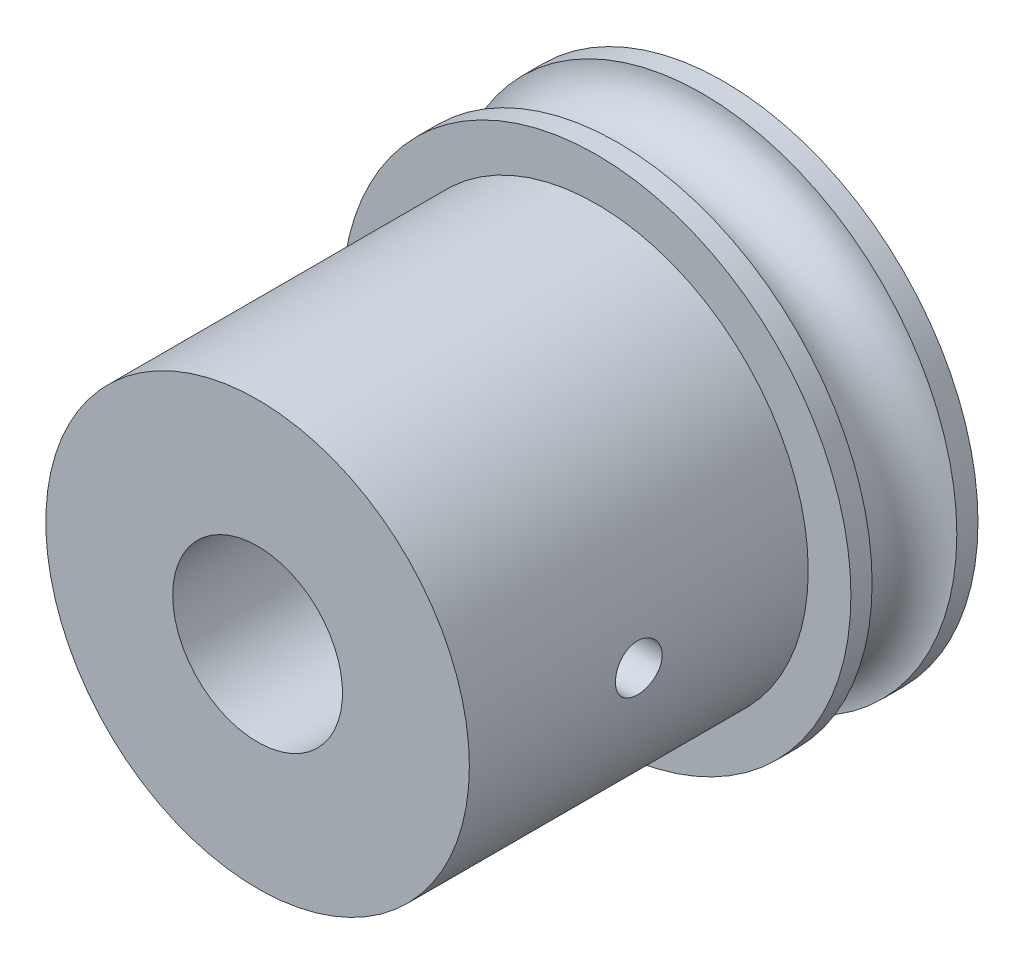
from build123d import *

# Parameters (mm, degrees)
SKETCH2_R           = 7.9375
BOSS_EXTRUDE1_DEPTH = 12.7
HOLE1_D             = 6.3627
SKETCH5_W           = 0.8763
SKETCH5_H           = 6.479418435


with BuildPart() as part:
    # Sketch1 → Revolve1 (revolve)
    with BuildSketch(Plane(origin=(0, 0, 0), x_dir=(1, 0, 0), z_dir=(0, 1, 0))):
        with BuildLine():
            Line((9.5377, 2.38125), (0, 2.38125))
            Line((0, 2.38125), (0, -2.38125))
            Line((0, -2.38125), (9.5377, -2.38125))
            Line((9.5377, -2.38125), (9.5377, -1.5875))
            ThreePointArc((9.5377, -1.5875), (7.9502, 0), (9.5377, 1.5875))
            Line((9.5377, 1.5875), (9.5377, 2.38125))
        make_face()
    revolve(axis=Axis((0, 0, -2.38125), (0, 0, 1)))

    # Sketch2 → Boss-Extrude1 (add)
    with BuildSketch(Plane.XY.offset(2.38125)):
        Circle(SKETCH2_R)
    extrude(amount=BOSS_EXTRUDE1_DEPTH)

    # Hole1 (through all)
    with Locations(Plane(origin=(0, 0, -2.38125), x_dir=(-1, 0, 0), z_dir=(0, 0, -1))):
        with Locations((0, 0)):
            Hole(HOLE1_D / 2)

    # Sketch5 → M1.6 Clearance Hole1 (revolve, cut)
    with BuildSketch(Plane(origin=(3.058281565, 0, 8.73125), x_dir=(0, 0, 1), z_dir=(0, 1, 0))):
        with Locations((0.43815, 3.239709218)):
            Rectangle(SKETCH5_W, SKETCH5_H)
    revolve(axis=Axis((-3.291718435, 0, 8.73125), (1, 0, 0)), mode=Mode.SUBTRACT)


solid = part.part
